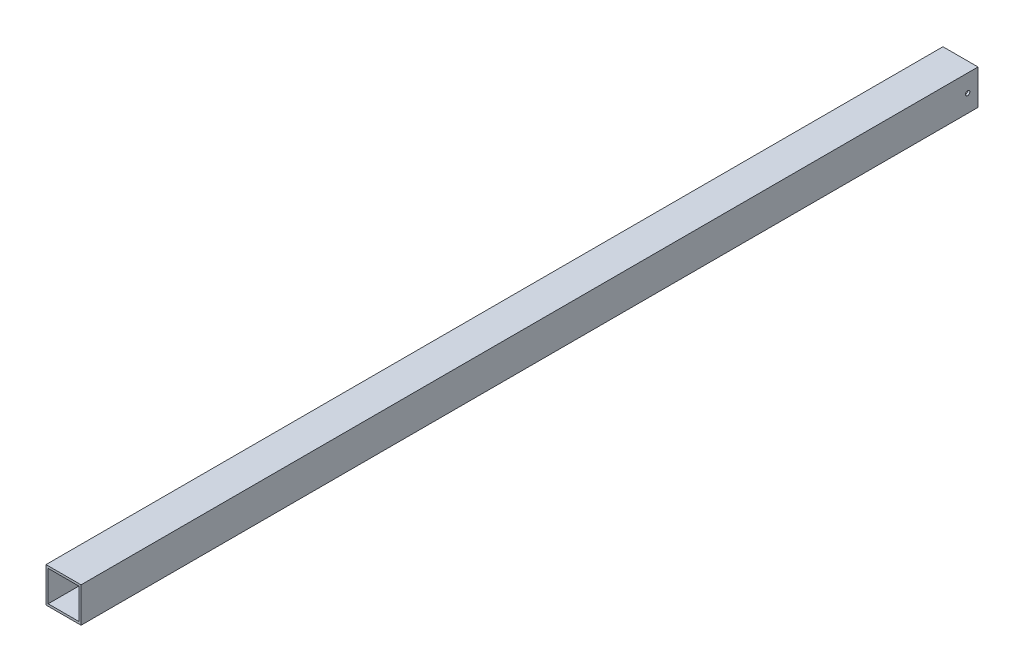
from build123d import *

# Parameters (mm, degrees)
ESQUISSE2_W                    = 50.8
ESQUISSE2_H                    = 50.8
ESQUISSE2_W_2                  = 44.45
ESQUISSE2_H_2                  = 44.45
BOSS_EXTRU_1_DEPTH             = 649.999999972
ESQUISSE4_R                    = 3.175
ENL_V_MAT_EXTRU_2_DEPTH        = 653.476666222
M4_CLEARANCE_HOLE1_D           = 4.5
M4_CLEARANCE_HOLE1_DEPTH       = 3.175
M4_CLEARANCE_HOLE1_CSINK_D     = 4.85
M4_CLEARANCE_HOLE1_CSINK_ANGLE = 90


with BuildPart() as part:
    # Esquisse2 → Boss.-Extru.1 (new, symmetric)
    with BuildSketch(Plane.XY):
        Rectangle(ESQUISSE2_W, ESQUISSE2_H)
        Rectangle(ESQUISSE2_W_2, ESQUISSE2_H_2, mode=Mode.SUBTRACT)
    extrude(amount=BOSS_EXTRU_1_DEPTH, both=True)

    # Esquisse4 → Enlèv. mat.-Extru.2 (cut, through all)
    with BuildSketch(Plane.ZY.offset(25.4)):
        with Locations((-634.999999972, 0)):
            Circle(ESQUISSE4_R)
    extrude(amount=-ENL_V_MAT_EXTRU_2_DEPTH, mode=Mode.SUBTRACT)

    # M4 Clearance Hole1
    with Locations(Plane.ZY.offset(25.4)):
        with Locations((517.099999972, -3.175), (557.099999972, -3.175), (597.099999972, -3.175)):
            CounterSinkHole(M4_CLEARANCE_HOLE1_D / 2, M4_CLEARANCE_HOLE1_CSINK_D / 2, depth=M4_CLEARANCE_HOLE1_DEPTH, counter_sink_angle=M4_CLEARANCE_HOLE1_CSINK_ANGLE)


solid = part.part
